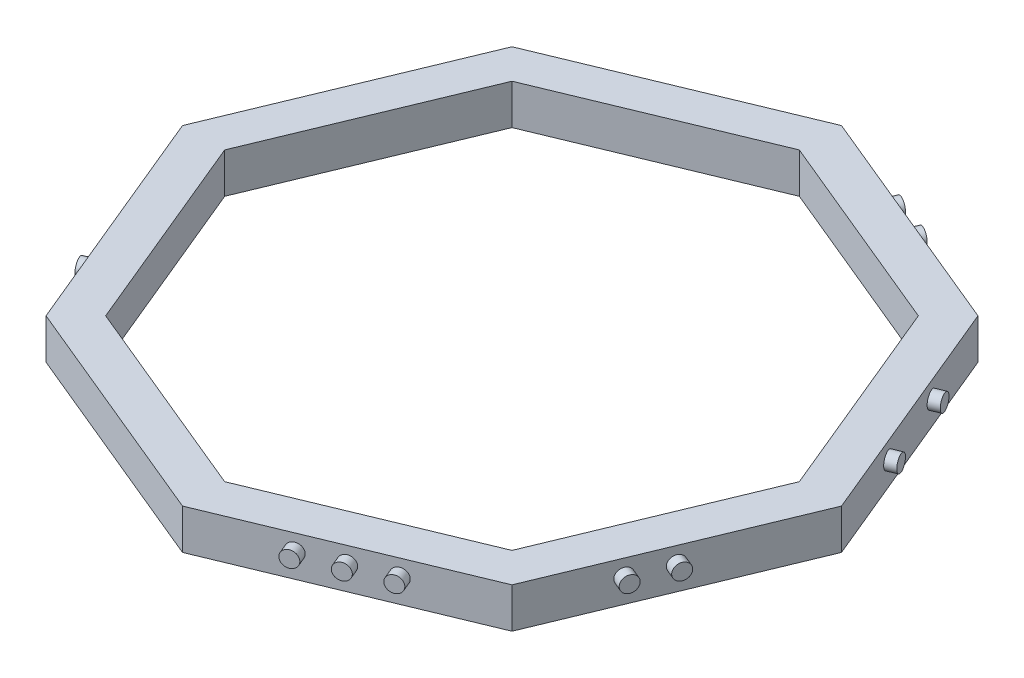
from build123d import *

# Parameters (mm, degrees)
BOSS_EXTRUDE1_DEPTH  = 5
CUT_EXTRUDE1_DEPTH   = 5
SKETCH6_R            = 1
BOSS_EXTRUDE5_DEPTH  = 1.25
SKETCH7_R            = 1
BOSS_EXTRUDE6_DEPTH  = 1.25
SKETCH8_R            = 1
BOSS_EXTRUDE7_DEPTH  = 1.25
BOSS_EXTRUDE8_START  = 1.25
SKETCH9_R            = 1
BOSS_EXTRUDE8_DEPTH  = 1.25
SKETCH10_R           = 1
BOSS_EXTRUDE12_DEPTH = 1.25
BOSS_EXTRUDE13_START = 1.25
SKETCH11_R           = 1
BOSS_EXTRUDE13_DEPTH = 1.25
BOSS_EXTRUDE14_START = 1.25
SKETCH12_R           = 1
BOSS_EXTRUDE14_DEPTH = 1.25


with BuildPart() as part:
    # Sketch3 → Boss-Extrude1 (new body)
    with BuildSketch(Plane(origin=(0, 0, 0), x_dir=(1, 0, 0), z_dir=(0, 1, 0))):
        Polygon((41, 0), (28.991378029, 28.991378029), (0, 41), (-28.991378029, 28.991378029), (-41, 0), (-28.991378029, -28.991378029), (0, -41), (28.991378029, -28.991378029), align=None)
    extrude(amount=BOSS_EXTRUDE1_DEPTH)

    # Sketch5 → Cut-Extrude1 (cut)
    with BuildSketch(Plane(origin=(0, 5, 0), x_dir=(1, 0, 0), z_dir=(0, 1, 0))):
        Polygon((35.75, 0), (25.279067427, 25.279067427), (0, 35.75), (-25.279067427, 25.279067427), (-35.75, 0), (-25.279067427, -25.279067427), (0, -35.75), (25.279067427, -25.279067427), align=None)
    extrude(amount=-CUT_EXTRUDE1_DEPTH, mode=Mode.SUBTRACT)

    # Sketch6 → Boss-Extrude5 (add)
    with BuildSketch(Plane(origin=(14.495689014, 0, 34.995689014), x_dir=(0.9238795325112827, 0, -0.38268343236509966), z_dir=(0.38268343236509966, 0, 0.9238795325112827))):
        with Locations(Location((0, 3, 0), (0, 0, 180))):
            Circle(SKETCH6_R)
        with Locations(Location((-5, 3, 0), (0, 0, 180))):
            Circle(SKETCH6_R)
        with Locations(Location((5, 3, 0), (0, 0, 180))):
            Circle(SKETCH6_R)
    extrude(amount=BOSS_EXTRUDE5_DEPTH)

    # Sketch7 → Boss-Extrude6 (add)
    with BuildSketch(Plane(origin=(-34.995689014, 0, 14.495689014), x_dir=(0.3826834323650997, 0, 0.9238795325112827), z_dir=(-0.9238795325112827, 0, 0.3826834323650997))):
        with Locations(Location((5, 3, 0), (0, 0, 180))):
            Circle(SKETCH7_R)
    extrude(amount=BOSS_EXTRUDE6_DEPTH)

    # Sketch8 → Boss-Extrude7 (add)
    with BuildSketch(Plane(origin=(-34.995689014, 0, -14.495689014), x_dir=(-0.3826834323650795, 0, 0.9238795325112911), z_dir=(-0.9238795325112911, 0, -0.3826834323650795))):
        with Locations(Location((0, 3, 0), (0, 0, 180))):
            Circle(SKETCH8_R)
    extrude(amount=BOSS_EXTRUDE7_DEPTH)

    # Sketch9 → Boss-Extrude8 (add)
    with BuildSketch(Plane(origin=(-14.495689014, 0, -34.995689014), x_dir=(-0.9238795325112826, 0, 0.38268343236509983), z_dir=(-0.38268343236509983, 0, -0.9238795325112826)).offset(BOSS_EXTRUDE8_START)):
        with Locations((-5, 3)):
            Circle(SKETCH9_R)
    extrude(amount=-BOSS_EXTRUDE8_DEPTH)

    # Sketch10 → Boss-Extrude12 (add)
    with BuildSketch(Plane(origin=(14.495689014, 0, -34.995689014), x_dir=(-0.923879532511291, 0, -0.38268343236507973), z_dir=(0.38268343236507973, 0, -0.923879532511291))):
        with Locations(Location((0, 3, 0), (0, 0, 180))):
            Circle(SKETCH10_R)
        with Locations(Location((5, 3, 0), (0, 0, 180))):
            Circle(SKETCH10_R)
    extrude(amount=BOSS_EXTRUDE12_DEPTH)

    # Sketch11 → Boss-Extrude13 (add)
    with BuildSketch(Plane(origin=(34.995689014, 0, -14.495689014), x_dir=(-0.3826834323651001, 0, -0.9238795325112825), z_dir=(0.9238795325112824, 0, -0.38268343236510005)).offset(BOSS_EXTRUDE13_START)):
        with Locations(Location((5, 3, 0), (0, 0, 180))):
            Circle(SKETCH11_R)
        with Locations((-5, 3)):
            Circle(SKETCH11_R)
    extrude(amount=-BOSS_EXTRUDE13_DEPTH)

    # Sketch12 → Boss-Extrude14 (add)
    with BuildSketch(Plane(origin=(34.995689014, 0, 14.495689014), x_dir=(0.3826834323650795, 0, -0.923879532511291), z_dir=(0.9238795325112911, 0, 0.38268343236507957)).offset(BOSS_EXTRUDE14_START)):
        with Locations((0, 3)):
            Circle(SKETCH12_R)
        with Locations(Location((-5, 3, 0), (0, 0, 180))):
            Circle(SKETCH12_R)
    extrude(amount=-BOSS_EXTRUDE14_DEPTH)


solid = part.part
